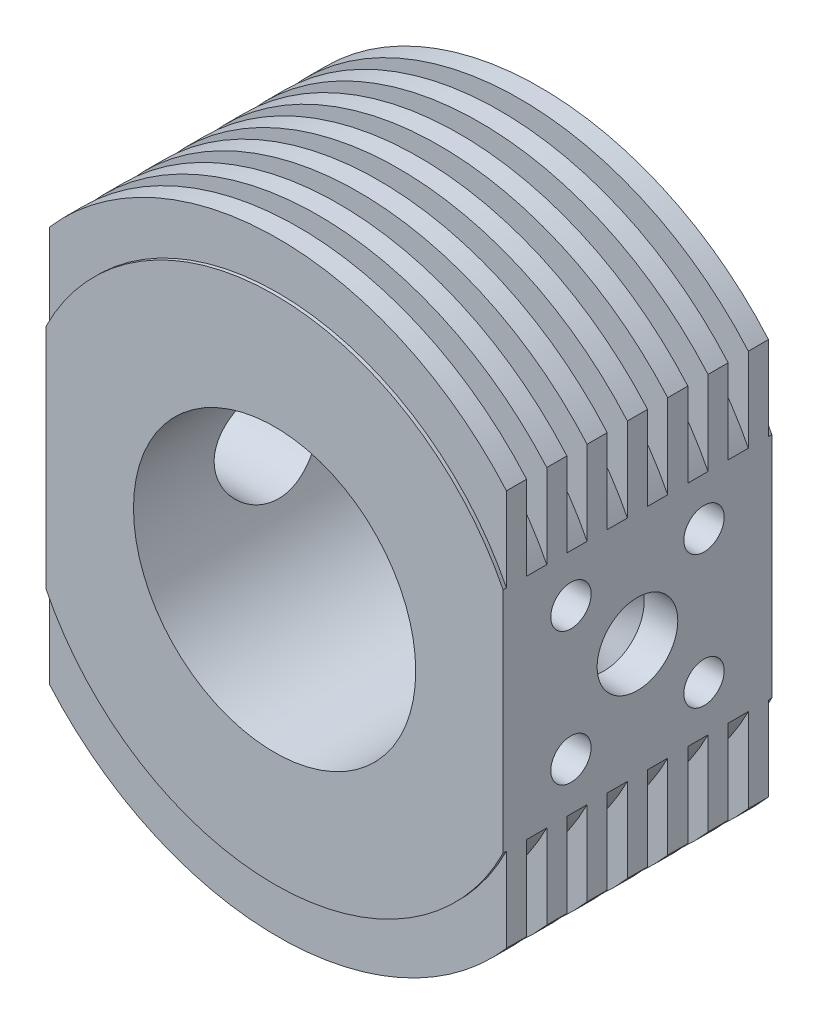
from build123d import *

# Parameters (mm, degrees)
SKETCH2_R            = 10.5
BOSS_EXTRUDE1_DEPTH  = 20
SKETCH3_R            = 12
CUT_EXTRUDE1_DEPTH   = 3
SKETCH4_OUTSIDE_W    = 47.968
SKETCH4_OUTSIDE_H    = 58.968
SKETCH4_OUTSIDE_R    = 19
CUT_EXTRUDE2_DEPTH   = 0.25
SKETCH5_OUTSIDE_W    = 47.968
SKETCH5_OUTSIDE_H    = 58.968
SKETCH5_OUTSIDE_R    = 19
CUT_EXTRUDE3_DEPTH   = 0.25
CUT_EXTRUDE4_START   = -1.5
CUT_EXTRUDE4_DEPTH   = 1.5
LPATTERN1_COUNT      = 6
LPATTERN1_PITCH      = 3
MIRROR3_START        = -1.5
MIRROR3_COPY_1_DEPTH = 1.5
MIRROR3_COPY_2_DEPTH = 1.5
MIRROR3_COPY_3_DEPTH = 1.5
MIRROR3_COPY_4_DEPTH = 1.5
MIRROR3_COPY_5_DEPTH = 1.5
SKETCH10_R           = 4
CUT_EXTRUDE5_DEPTH   = 9.5
SKETCH11_R           = 1.5
CUT_EXTRUDE6_DEPTH   = 4


with BuildPart() as part:
    # Sketch2 → Boss-Extrude1 (new body)
    with BuildSketch(Plane.XY):
        with BuildLine():
            Line((-17, 14.739402973), (-17, -14.739402973))
            ThreePointArc((-17, -14.739402973), (0, -22.5), (17, -14.739402973))
            Line((17, -14.739402973), (17, 14.739402973))
            ThreePointArc((17, 14.739402973), (0, 22.5), (-17, 14.739402973))
        make_face()
        Circle(SKETCH2_R, mode=Mode.SUBTRACT)
    extrude(amount=BOSS_EXTRUDE1_DEPTH)

    # Sketch3 → Cut-Extrude1 (cut)
    with BuildSketch(Plane(origin=(0, 0, 0), x_dir=(-1, 0, 0), z_dir=(0, 0, -1))):
        Circle(SKETCH3_R)
    extrude(amount=-CUT_EXTRUDE1_DEPTH, mode=Mode.SUBTRACT)

    # Sketch4 outside → Cut-Extrude2 (cut)
    with BuildSketch(Plane.XY.offset(20)):
        Rectangle(SKETCH4_OUTSIDE_W, SKETCH4_OUTSIDE_H)
        Circle(SKETCH4_OUTSIDE_R, mode=Mode.SUBTRACT)
    extrude(amount=-CUT_EXTRUDE2_DEPTH, mode=Mode.SUBTRACT)

    # Sketch5 outside → Cut-Extrude3 (cut)
    with BuildSketch(Plane(origin=(0, 0, 0), x_dir=(-1, 0, 0), z_dir=(0, 0, -1))):
        Rectangle(SKETCH5_OUTSIDE_W, SKETCH5_OUTSIDE_H)
        Circle(SKETCH5_OUTSIDE_R, mode=Mode.SUBTRACT)
    extrude(amount=-CUT_EXTRUDE3_DEPTH, mode=Mode.SUBTRACT)

    # Sketch8 → Cut-Extrude4 (cut)
    with BuildSketch(Plane.XY.offset(18.25).offset(CUT_EXTRUDE4_START)):
        with BuildLine():
            Line((17, 8.485281374), (17, 14.739402973))
            ThreePointArc((17, 14.739402973), (0, 22.5), (-17, 14.739402973))
            Line((-17, 14.739402973), (-17, 8.485281374))
            ThreePointArc((-17, 8.485281374), (0, 19), (17, 8.485281374))
        make_face()
    cut_extrude4 = extrude(amount=CUT_EXTRUDE4_DEPTH, mode=Mode.SUBTRACT)

    # LPattern1: Cut-Extrude4 ×6
    with Locations(*[(0, 0, -i * LPATTERN1_PITCH) for i in range(1, LPATTERN1_COUNT)]):
        add(cut_extrude4, mode=Mode.SUBTRACT)

    # Mirror3: Cut-Extrude4 across plane
    add(cut_extrude4.mirror(Plane.ZX), mode=Mode.SUBTRACT)

    # Mirror3 copy 1 sketch → Mirror3 copy 1 (cut)
    with BuildSketch(Plane.XY.offset(15.25).offset(MIRROR3_START)):
        with BuildLine():
            Line((17, -8.485281374), (17, -14.739402973))
            ThreePointArc((17, -14.739402973), (0, -22.5), (-17, -14.739402973))
            Line((-17, -14.739402973), (-17, -8.485281374))
            ThreePointArc((-17, -8.485281374), (0, -19), (17, -8.485281374))
        make_face()
    extrude(amount=MIRROR3_COPY_1_DEPTH, mode=Mode.SUBTRACT)

    # Mirror3 copy 2 sketch → Mirror3 copy 2 (cut)
    with BuildSketch(Plane.XY.offset(12.25).offset(MIRROR3_START)):
        with BuildLine():
            Line((17, -8.485281374), (17, -14.739402973))
            ThreePointArc((17, -14.739402973), (0, -22.5), (-17, -14.739402973))
            Line((-17, -14.739402973), (-17, -8.485281374))
            ThreePointArc((-17, -8.485281374), (0, -19), (17, -8.485281374))
        make_face()
    extrude(amount=MIRROR3_COPY_2_DEPTH, mode=Mode.SUBTRACT)

    # Mirror3 copy 3 sketch → Mirror3 copy 3 (cut)
    with BuildSketch(Plane.XY.offset(9.25).offset(MIRROR3_START)):
        with BuildLine():
            Line((17, -8.485281374), (17, -14.739402973))
            ThreePointArc((17, -14.739402973), (0, -22.5), (-17, -14.739402973))
            Line((-17, -14.739402973), (-17, -8.485281374))
            ThreePointArc((-17, -8.485281374), (0, -19), (17, -8.485281374))
        make_face()
    extrude(amount=MIRROR3_COPY_3_DEPTH, mode=Mode.SUBTRACT)

    # Mirror3 copy 4 sketch → Mirror3 copy 4 (cut)
    with BuildSketch(Plane.XY.offset(6.25).offset(MIRROR3_START)):
        with BuildLine():
            Line((17, -8.485281374), (17, -14.739402973))
            ThreePointArc((17, -14.739402973), (0, -22.5), (-17, -14.739402973))
            Line((-17, -14.739402973), (-17, -8.485281374))
            ThreePointArc((-17, -8.485281374), (0, -19), (17, -8.485281374))
        make_face()
    extrude(amount=MIRROR3_COPY_4_DEPTH, mode=Mode.SUBTRACT)

    # Mirror3 copy 5 sketch → Mirror3 copy 5 (cut)
    with BuildSketch(Plane.XY.offset(3.25).offset(MIRROR3_START)):
        with BuildLine():
            Line((17, -8.485281374), (17, -14.739402973))
            ThreePointArc((17, -14.739402973), (0, -22.5), (-17, -14.739402973))
            Line((-17, -14.739402973), (-17, -8.485281374))
            ThreePointArc((-17, -8.485281374), (0, -19), (17, -8.485281374))
        make_face()
    extrude(amount=MIRROR3_COPY_5_DEPTH, mode=Mode.SUBTRACT)

    # Sketch10 → Cut-Extrude5 (cut)
    with BuildSketch(Plane.ZY.offset(17)):
        with Locations((10, 0)):
            Circle(SKETCH10_R)
    extrude(amount=-CUT_EXTRUDE5_DEPTH, mode=Mode.SUBTRACT)

    # Sketch11 → Cut-Extrude6 (cut)
    with BuildSketch(Plane.ZY.offset(17)):
        with Locations((5.050252532, 4.949747468)):
            Circle(SKETCH11_R)
        with Locations((5.050252532, -4.949747468)):
            Circle(SKETCH11_R)
        with Locations((14.949747468, -4.949747468)):
            Circle(SKETCH11_R)
        with Locations((14.949747468, 4.949747468)):
            Circle(SKETCH11_R)
    cut_extrude6 = extrude(amount=-CUT_EXTRUDE6_DEPTH, mode=Mode.SUBTRACT)

    # Sketch14 → Cut-Revolve1 (revolve, cut)
    with BuildSketch(Plane(origin=(0, 0, 10), x_dir=(-1, 0, 0), z_dir=(0, 0, -1)), mode=Mode.PRIVATE) as cut_revolve1_sk:
        Polygon((-17, 0), (-11.5, 0), (-14.5, -3), (-17, -3), align=None)
    revolve(cut_revolve1_sk.sketch.rotate(Axis((17, 0, 10), (-1, 0, 0)), 270), axis=Axis((17, 0, 10), (-1, 0, 0)), mode=Mode.SUBTRACT)

    # Mirror4: Cut-Extrude6 across plane
    add(cut_extrude6.mirror(Plane(origin=(0, 0, 0), x_dir=(0, 0, 1), z_dir=(1, 0, 0))), mode=Mode.SUBTRACT)


solid = part.part
